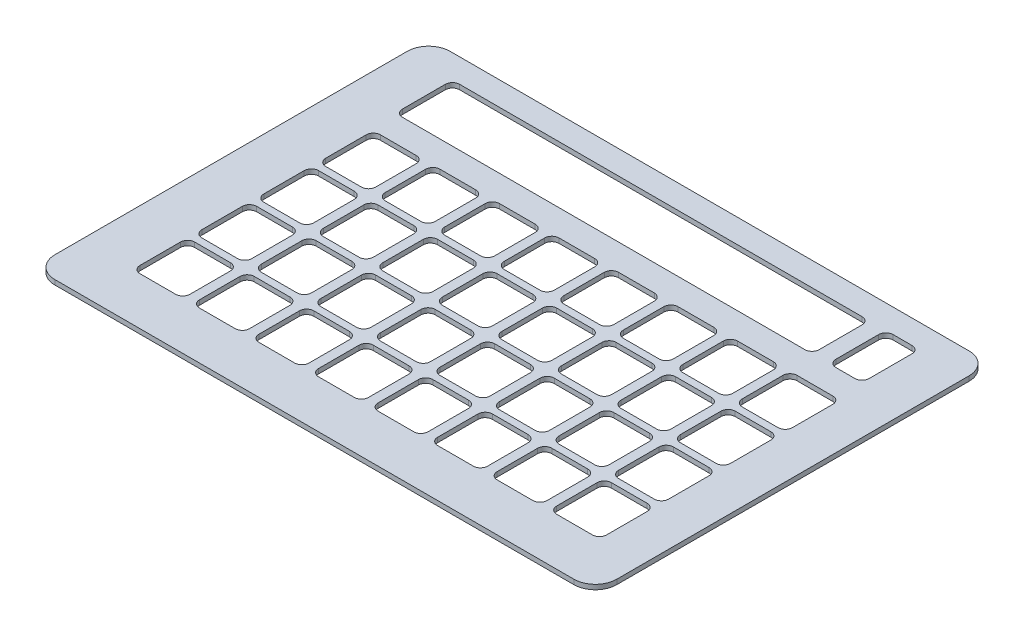
from build123d import *

# Parameters (mm, degrees)
SKETCH1_W           = 236
SKETCH1_H           = 166
OUTER_PROFILE_DEPTH = 1
SKETCH2_W           = 236
SKETCH2_H           = 166
INNER_PROFILE_DEPTH = 1
FILLET1_R           = 9
CUTOUT_DEPTH        = 145.280975877
CUTOUTS_COUNT       = 8
CUTOUTS_PITCH       = 25
CUTOUTS_COUNT_DIR2  = 4
CUTOUTS_PITCH_DIR2  = 26
TOP_DEPTH           = 145.280975877


with BuildPart() as part:
    # Sketch1 → Outer Profile (new body)
    with BuildSketch(Plane(origin=(0, 0, 0), x_dir=(1, 0, 0), z_dir=(0, 1, 0))):
        Rectangle(SKETCH1_W, SKETCH1_H)
    extrude(amount=OUTER_PROFILE_DEPTH)

    # Sketch2 → Inner Profile (add)
    with BuildSketch(Plane(origin=(0, 1, 0), x_dir=(1, 0, 0), z_dir=(0, 1, 0))):
        Rectangle(SKETCH2_W, SKETCH2_H)
    extrude(amount=INNER_PROFILE_DEPTH)

    # Fillet1
    fillet1_edges = [part.edges().sort_by_distance(p)[0] for p in [
        (118, 1, 83),
        (-118, 1, 83),
        (-118, 1, -83),
        (118, 1, -83),
    ]]
    fillet(fillet1_edges, radius=FILLET1_R)

    # Sketch3 → Cutout (cut, through all)
    with BuildSketch(Plane(origin=(0, 2, 0), x_dir=(1, 0, 0), z_dir=(0, 1, 0))):
        with BuildLine():
            Line((-93.25, -63), (-78.25, -63))
            ThreePointArc((-78.25, -63), (-76.128679656, -62.121320344), (-75.25, -60))
            Line((-75.25, -60), (-75.25, -43))
            ThreePointArc((-75.25, -43), (-76.128679656, -40.878679656), (-78.25, -40))
            Line((-78.25, -40), (-93.25, -40))
            ThreePointArc((-93.25, -40), (-95.371320344, -40.878679656), (-96.25, -43))
            Line((-96.25, -43), (-96.25, -60))
            ThreePointArc((-96.25, -60), (-95.371320344, -62.121320344), (-93.25, -63))
        make_face()
    cutout = extrude(amount=-CUTOUT_DEPTH, mode=Mode.SUBTRACT)

    # Cutouts: Cutout 8 × 4
    with Locations(*[(i * CUTOUTS_PITCH, 0, -j * CUTOUTS_PITCH_DIR2) for i in range(CUTOUTS_COUNT) for j in range(CUTOUTS_COUNT_DIR2) if (i, j) != (0, 0)]):
        add(cutout, mode=Mode.SUBTRACT)

    # Sketch9 → Top (cut, through all)
    with BuildSketch(Plane(origin=(0, 2, 0), x_dir=(1, 0, 0), z_dir=(0, 1, 0))):
        with BuildLine():
            Line((-95, 49), (74, 49))
            ThreePointArc((74, 49), (76.121320344, 49.878679656), (77, 52))
            Line((77, 52), (77, 70))
            ThreePointArc((77, 70), (76.121320344, 72.121320344), (74, 73))
            Line((74, 73), (-95, 73))
            ThreePointArc((-95, 73), (-97.121320344, 72.121320344), (-98, 70))
            Line((-98, 70), (-98, 52))
            ThreePointArc((-98, 52), (-97.121320344, 49.878679656), (-95, 49))
        make_face()
        with BuildLine():
            Line((87, 49), (95, 49))
            ThreePointArc((95, 49), (97.121320344, 49.878679656), (98, 52))
            Line((98, 52), (98, 70))
            ThreePointArc((98, 70), (97.121320344, 72.121320344), (95, 73))
            Line((95, 73), (87, 73))
            ThreePointArc((87, 73), (84.878679656, 72.121320344), (84, 70))
            Line((84, 70), (84, 52))
            ThreePointArc((84, 52), (84.878679656, 49.878679656), (87, 49))
        make_face()
    extrude(amount=-TOP_DEPTH, mode=Mode.SUBTRACT)


solid = part.part
